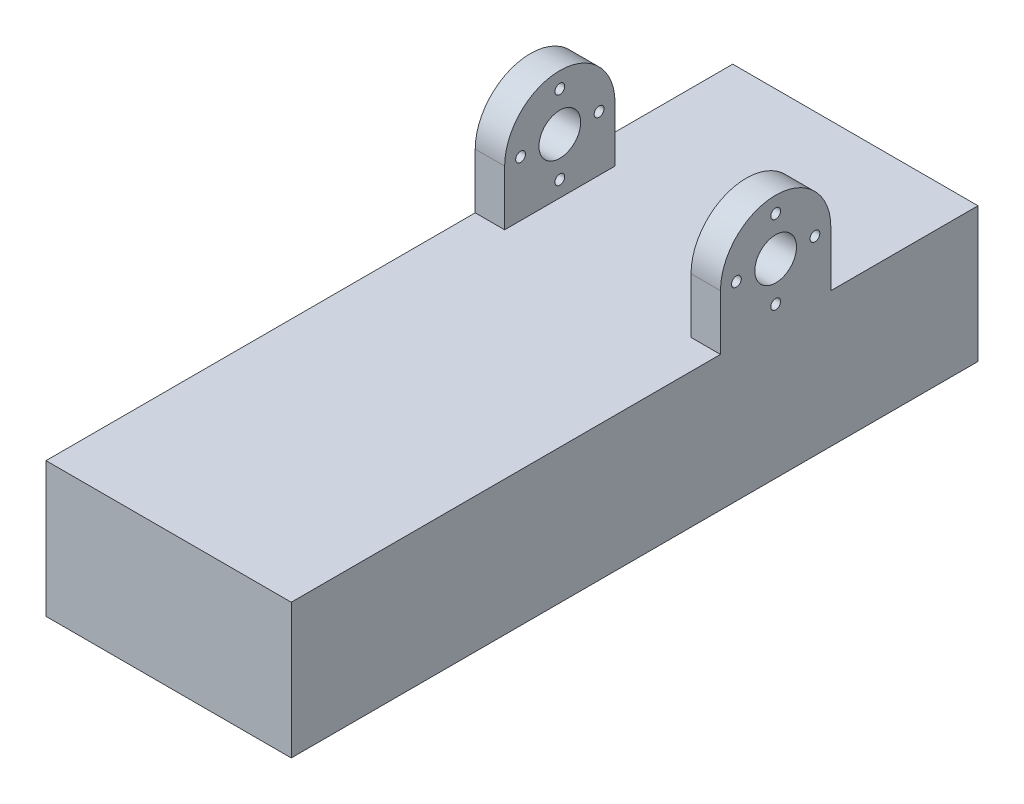
from build123d import *

# Parameters (mm, degrees)
SKETCH1_W           = 50
SKETCH1_H           = 170
BOSS_EXTRUDE1_DEPTH = 55
SKETCH2_W           = 34
SKETCH2_H           = 27
CUT_EXTRUDE1_DEPTH  = 181.416185527
SKETCH3_W           = 10
SKETCH3_H           = 24
SKETCH3_R           = 4.25
SKETCH3_R_2         = 1
CUT_EXTRUDE2_DEPTH  = 186.539753153
SKETCH4_W           = 2
SKETCH4_H           = 24
CUT_EXTRUDE3_DEPTH  = 178.623196683
SKETCH5_W           = 6.25
SKETCH5_H           = 11.25
CUT_EXTRUDE4_DEPTH  = 186.539753153
SKETCH6_W           = 38
SKETCH6_H           = 10
CUT_EXTRUDE5_DEPTH  = 181.416185527
SKETCH8_W           = 13.25
SKETCH8_H           = 2.25
CUT_EXTRUDE7_DEPTH  = 186.539753153
SKETCH9_W           = 34
SKETCH9_H           = 35.25
CUT_EXTRUDE8_DEPTH  = 179.297679458
SKETCH11_W          = 13.25
SKETCH11_H          = 20.25
CUT_EXTRUDE9_DEPTH  = 184.480414486
SKETCH12_W          = 28.5
SKETCH12_H          = 15
BOSS_EXTRUDE2_DEPTH = 8
SKETCH14_W          = 34
SKETCH14_H          = 15
SKETCH14_H_2        = 10.25
BOSS_EXTRUDE3_DEPTH = 13.25
SKETCH16_R          = 4.5
SKETCH16_R_2        = 2.5
CUT_EXTRUDE13_DEPTH = 8
SKETCH17_R          = 4.5
SKETCH17_W          = 55
SKETCH17_H          = 10.25
CUT_EXTRUDE15_DEPTH = 175.384811552
SKETCH18_W          = 71.25
SKETCH18_H          = 27.5
SKETCH18_W_2        = 13.75
SKETCH18_W_3        = 16.25
BOSS_EXTRUDE4_DEPTH = 50


with BuildPart() as part:
    # Sketch1 → Boss-Extrude1 (new body)
    with BuildSketch(Plane.XY):
        with Locations((0, -85)):
            Rectangle(SKETCH1_W, SKETCH1_H)
    extrude(amount=-BOSS_EXTRUDE1_DEPTH)

    # Sketch2 → Cut-Extrude1 (cut, through all)
    with BuildSketch(Plane.XY):
        with Locations((0, -13.5)):
            Rectangle(SKETCH2_W, SKETCH2_H)
    extrude(amount=-CUT_EXTRUDE1_DEPTH, mode=Mode.SUBTRACT)

    # Sketch3 → Cut-Extrude2 (cut, through all)
    with BuildSketch(Plane(origin=(25, 0, 0), x_dir=(0, 0, -1), z_dir=(1, 0, 0))):
        with Locations((50, -12)):
            Rectangle(SKETCH3_W, SKETCH3_H)
        with Locations((5, -12)):
            Rectangle(SKETCH3_W, SKETCH3_H)
        with Locations(Location((27.5, -12.75, 0), (0, 0, 90))):
            Circle(SKETCH3_R)
        with Locations(Location((35.5, -12.75, 0), (0, 0, 90))):
            Circle(SKETCH3_R_2)
        with Locations(Location((27.5, -4.75, 0), (0, 0, 90))):
            Circle(SKETCH3_R_2)
        with Locations(Location((27.5, -20.75, 0), (0, 0, 90))):
            Circle(SKETCH3_R_2)
        with Locations(Location((19.5, -12.75, 0), (0, 0, 90))):
            Circle(SKETCH3_R_2)
    extrude(amount=-CUT_EXTRUDE2_DEPTH, mode=Mode.SUBTRACT)

    # Sketch4 → Cut-Extrude3 (cut, through all)
    with BuildSketch(Plane.XY.offset(-10)):
        with Locations((-18, -12)):
            Rectangle(SKETCH4_W, SKETCH4_H)
        with Locations((18, -12)):
            Rectangle(SKETCH4_W, SKETCH4_H)
    extrude(amount=-CUT_EXTRUDE3_DEPTH, mode=Mode.SUBTRACT)

    # Sketch5 → Cut-Extrude4 (cut, through all)
    with BuildSketch(Plane(origin=(25, 0, 0), x_dir=(0, 0, -1), z_dir=(1, 0, 0))):
        with BuildLine():
            Line((45, 0), (10, 0))
            Line((10, 0), (10, -12.75))
            Line((10, -12.75), (16.25, -12.75))
            ThreePointArc((16.25, -12.75), (27.5, -1.5), (38.75, -12.75))
            Line((38.75, -12.75), (45, -12.75))
            Line((45, -12.75), (45, 0))
        make_face()
        with Locations((13.125, -18.375)):
            Rectangle(SKETCH5_W, SKETCH5_H)
        with Locations((41.875, -18.375)):
            Rectangle(SKETCH5_W, SKETCH5_H)
    extrude(amount=-CUT_EXTRUDE4_DEPTH, mode=Mode.SUBTRACT)

    # Sketch6 → Cut-Extrude5 (cut, through all)
    with BuildSketch(Plane.XY):
        with Locations((0, -29)):
            Rectangle(SKETCH6_W, SKETCH6_H)
    extrude(amount=-CUT_EXTRUDE5_DEPTH, mode=Mode.SUBTRACT)

    # Sketch8 → Cut-Extrude7 (cut, through all)
    with BuildSketch(Plane(origin=(25, 0, 0), x_dir=(0, 0, -1), z_dir=(1, 0, 0))):
        with BuildLine():
            Line((27.5, -157.5), (27.5, -132.5))
            Line((27.5, -132.5), (13.25, -132.5))
            Line((13.25, -132.5), (13.25, -167.75))
            Line((13.25, -167.75), (17.25, -167.75))
            ThreePointArc((17.25, -167.75), (20.252155493, -160.502155493), (27.5, -157.5))
        make_face()
        with BuildLine():
            Line((41.75, -167.75), (41.75, -132.5))
            Line((41.75, -132.5), (27.5, -132.5))
            Line((27.5, -132.5), (27.5, -157.5))
            ThreePointArc((27.5, -157.5), (34.747844507, -160.502155493), (37.75, -167.75))
            Line((37.75, -167.75), (41.75, -167.75))
        make_face()
        with Locations((48.375, -168.875)):
            Rectangle(SKETCH8_W, SKETCH8_H)
        with Locations((6.625, -168.875)):
            Rectangle(SKETCH8_W, SKETCH8_H)
        with BuildLine():
            Line((17.25, -167.75), (13.25, -167.75))
            Line((13.25, -167.75), (13.25, -170))
            Line((13.25, -170), (17.5, -170))
            ThreePointArc((17.5, -170), (17.31269172, -168.881923142), (17.25, -167.75))
        make_face()
        with BuildLine():
            Line((41.75, -170), (41.75, -167.75))
            Line((41.75, -167.75), (37.75, -167.75))
            ThreePointArc((37.75, -167.75), (37.68730828, -168.881923142), (37.5, -170))
            Line((37.5, -170), (41.75, -170))
        make_face()
        with BuildLine():
            Line((27.5, -167.75), (27.5, -157.5))
            ThreePointArc((27.5, -157.5), (20.252155493, -160.502155493), (17.25, -167.75))
            Line((17.25, -167.75), (27.5, -167.75))
        make_face()
        with BuildLine():
            ThreePointArc((37.75, -167.75), (34.747844507, -160.502155493), (27.5, -157.5))
            Line((27.5, -157.5), (27.5, -167.75))
            Line((27.5, -167.75), (37.75, -167.75))
        make_face()
        with BuildLine():
            Line((27.5, -170), (27.5, -167.75))
            Line((27.5, -167.75), (17.25, -167.75))
            ThreePointArc((17.25, -167.75), (17.31269172, -168.881923142), (17.5, -170))
            Line((17.5, -170), (27.5, -170))
        make_face()
        with BuildLine():
            ThreePointArc((37.5, -170), (37.68730828, -168.881923142), (37.75, -167.75))
            Line((37.75, -167.75), (27.5, -167.75))
            Line((27.5, -167.75), (27.5, -170))
            Line((27.5, -170), (37.5, -170))
        make_face()
    extrude(amount=-CUT_EXTRUDE7_DEPTH, mode=Mode.SUBTRACT)

    # Sketch9 → Cut-Extrude8 (cut, through all)
    with BuildSketch(Plane.XY):
        with Locations((0, -150.125)):
            Rectangle(SKETCH9_W, SKETCH9_H)
    extrude(amount=-CUT_EXTRUDE8_DEPTH, mode=Mode.SUBTRACT)

    # Sketch11 → Cut-Extrude9 (cut, through all)
    with BuildSketch(Plane(origin=(25, 0, 0), x_dir=(0, 0, -1), z_dir=(1, 0, 0))):
        with BuildLine():
            ThreePointArc((17.25, -167.75), (20.252155493, -160.502155493), (27.5, -157.5))
            Line((27.5, -157.5), (27.5, -147.5))
            Line((27.5, -147.5), (13.25, -147.5))
            Line((13.25, -147.5), (13.25, -167.75))
            Line((13.25, -167.75), (17.25, -167.75))
        make_face()
        with BuildLine():
            Line((27.5, -147.5), (27.5, -157.5))
            ThreePointArc((27.5, -157.5), (34.747844507, -160.502155493), (37.75, -167.75))
            Line((37.75, -167.75), (41.75, -167.75))
            Line((41.75, -167.75), (41.75, -147.5))
            Line((41.75, -147.5), (27.5, -147.5))
        make_face()
        with Locations((48.375, -157.625)):
            Rectangle(SKETCH11_W, SKETCH11_H)
        with Locations((6.625, -157.625)):
            Rectangle(SKETCH11_W, SKETCH11_H)
    extrude(amount=-CUT_EXTRUDE9_DEPTH, mode=Mode.SUBTRACT)

    # Sketch12 → Boss-Extrude2 (add)
    with BuildSketch(Plane(origin=(25, 0, 0), x_dir=(0, 0, -1), z_dir=(1, 0, 0))):
        with Locations((27.5, -140)):
            Rectangle(SKETCH12_W, SKETCH12_H)
    boss_extrude2 = extrude(amount=-BOSS_EXTRUDE2_DEPTH)

    # Mirror1: Boss-Extrude2 across plane
    add(boss_extrude2.mirror(Plane(origin=(0, 0, 0), x_dir=(0, 0, 1), z_dir=(1, 0, 0))))

    # Sketch14 → Boss-Extrude3 (add)
    with BuildSketch(Plane.XY):
        with Locations((0, -140)):
            Rectangle(SKETCH14_W, SKETCH14_H)
        with Locations((0, -152.625)):
            Rectangle(SKETCH14_W, SKETCH14_H_2)
    boss_extrude3 = extrude(amount=-BOSS_EXTRUDE3_DEPTH)

    # Mirror2: Boss-Extrude3 across plane
    add(boss_extrude3.mirror(Plane.XY.offset(-27.5)))

    # Sketch16 → Cut-Extrude13 (cut)
    # profile 1 of 3: a face of its own
    with BuildSketch(Plane(origin=(25, 0, 0), x_dir=(0, 0, -1), z_dir=(1, 0, 0))):
        with Locations(Location((16.5, -135.75, 0), (0, 0, 90))):
            Circle(SKETCH16_R)
        with Locations((16.5, -135.75)):
            Circle(SKETCH16_R_2, mode=Mode.SUBTRACT)
    # profile 2 of 3: a face of its own
    with BuildSketch(Plane(origin=(25, 0, 0), x_dir=(0, 0, -1), z_dir=(1, 0, 0))):
        with Locations((16.5, -135.75)):
            Circle(SKETCH16_R_2)
    # profile 3 of 3: a face of its own
    with BuildSketch(Plane(origin=(25, 0, 0), x_dir=(0, 0, -1), z_dir=(1, 0, 0))):
        with Locations(Location((38.5, -135.75, 0), (0, 0, 90))):
            Circle(SKETCH16_R)
    cut_extrude13 = extrude(amount=-CUT_EXTRUDE13_DEPTH, mode=Mode.SUBTRACT)

    # Mirror3: Cut-Extrude13 across plane
    add(cut_extrude13.mirror(Plane(origin=(0, 0, 0), x_dir=(0, 0, 1), z_dir=(1, 0, 0))), mode=Mode.SUBTRACT)

    # Sketch17 → Cut-Extrude15 (cut, through all)
    # profile 1 of 4: a face of its own
    with BuildSketch(Plane(origin=(25, 0, 0), x_dir=(0, 0, -1), z_dir=(1, 0, 0))):
        Polygon((55, -51.5), (27.5, -51.5), (0, -51.5), (0, -147.5), (55, -147.5), align=None)
        with Locations((16.5, -135.75)):
            Circle(SKETCH17_R, mode=Mode.SUBTRACT)
        with Locations((38.5, -135.75)):
            Circle(SKETCH17_R, mode=Mode.SUBTRACT)
    # profile 2 of 4: a face of its own
    with BuildSketch(Plane(origin=(25, 0, 0), x_dir=(0, 0, -1), z_dir=(1, 0, 0))):
        with Locations((27.5, -152.625)):
            Rectangle(SKETCH17_W, SKETCH17_H)
    # profile 3 of 4: a face of its own
    with BuildSketch(Plane(origin=(25, 0, 0), x_dir=(0, 0, -1), z_dir=(1, 0, 0))):
        with Locations((38.5, -135.75)):
            Circle(SKETCH17_R)
    # profile 4 of 4: a face of its own
    with BuildSketch(Plane(origin=(25, 0, 0), x_dir=(0, 0, -1), z_dir=(1, 0, 0))):
        with Locations((16.5, -135.75)):
            Circle(SKETCH17_R)
    extrude(amount=-CUT_EXTRUDE15_DEPTH, mode=Mode.SUBTRACT)

    # Sketch18 → Boss-Extrude4 (add)
    with BuildSketch(Plane(origin=(25, 0, 0), x_dir=(0, 0, -1), z_dir=(1, 0, 0))):
        with Locations((-35.625, -37.75)):
            Rectangle(SKETCH18_W, SKETCH18_H)
        with Locations((61.875, -37.75)):
            Rectangle(SKETCH18_W_2, SKETCH18_H)
        Polygon((38.75, -51.5), (38.75, -24), (16.25, -24), (0, -24), (0, -51.5), align=None)
        with Locations((46.875, -37.75)):
            Rectangle(SKETCH18_W_3, SKETCH18_H)
    extrude(amount=-BOSS_EXTRUDE4_DEPTH)


solid = part.part
